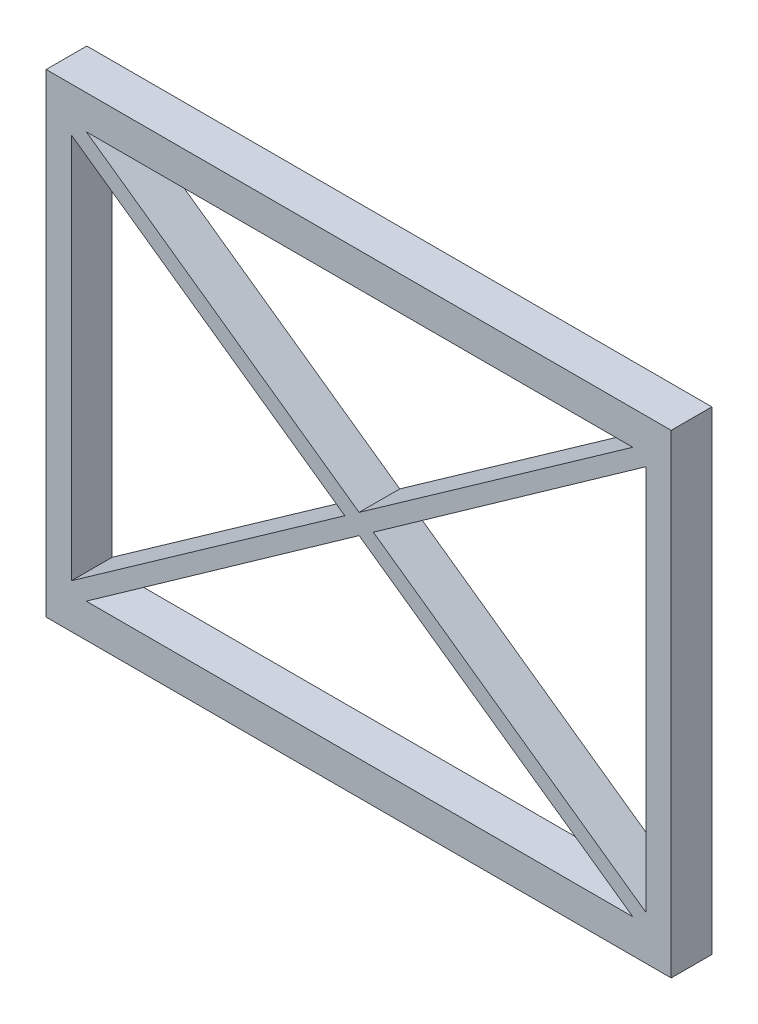
from build123d import *

# Parameters (mm, degrees)
SKETCH1_W           = 73.8
SKETCH1_H           = 4.8
BOSS_EXTRUDE1_DEPTH = 56
CUT_EXTRUDE1_DEPTH  = 56


with BuildPart() as part:
    # Sketch1 → Boss-Extrude1 (new body)
    with BuildSketch(Plane(origin=(0, 0, 0), x_dir=(1, 0, 0), z_dir=(0, 1, 0))):
        with Locations((35.965315315, -0.302702703)):
            Rectangle(SKETCH1_W, SKETCH1_H)
    extrude(amount=BOSS_EXTRUDE1_DEPTH)

    # Sketch2 → Cut-Extrude1 (cut)
    with BuildSketch(Plane.XY.offset(2.702702703)):
        Polygon((68.331260978, 52), (3.799369653, 52), (36.016550131, 29.189615872), align=None)
        Polygon((34.331260978, 28), (2.065315315, 50.775961644), (2.065315315, 5.224038356), align=None)
        Polygon((36.016550131, 26.810384128), (3.799369653, 4), (68.331260978, 4), align=None)
        Polygon((69.865315315, 5.224038356), (69.865315315, 50.775961644), (37.696752842, 28), align=None)
    extrude(amount=-CUT_EXTRUDE1_DEPTH, mode=Mode.SUBTRACT)


solid = part.part
